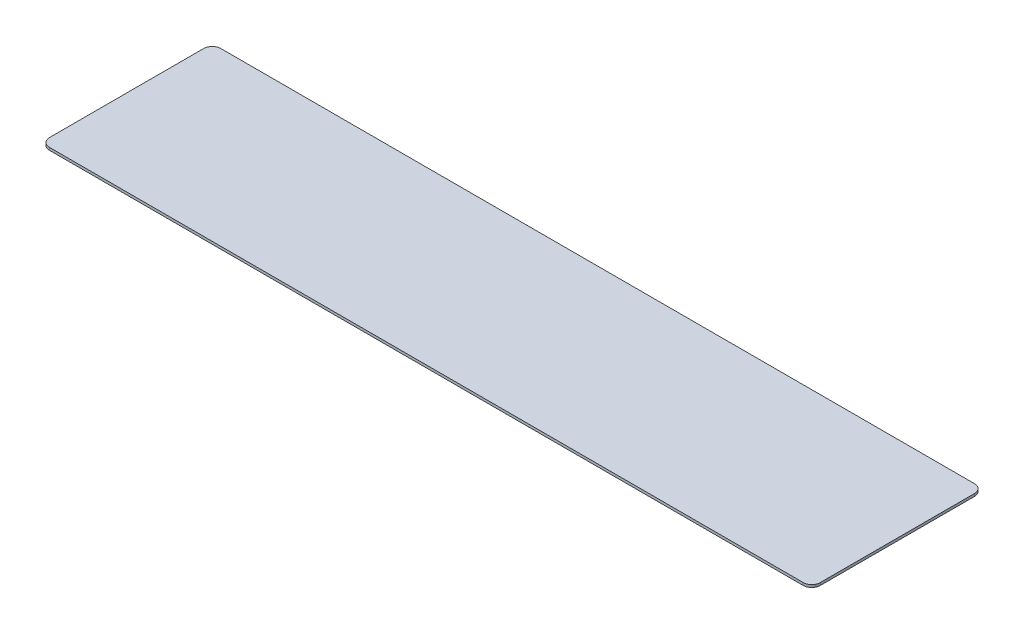
from build123d import *

# Parameters (mm, degrees)
SKETCH1_W           = 900
SKETCH1_H           = 200
BOSS_EXTRUDE1_DEPTH = 3
FILLET2_R           = 10


with BuildPart() as part:
    # Sketch1 → Boss-Extrude1 (new body)
    with BuildSketch(Plane(origin=(0, 0, 0), x_dir=(1, 0, 0), z_dir=(0, 1, 0))):
        with Locations((450, 100)):
            Rectangle(SKETCH1_W, SKETCH1_H)
    extrude(amount=BOSS_EXTRUDE1_DEPTH)

    # Fillet2
    fillet2_edges = [part.edges().sort_by_distance(p)[0] for p in [
        (0, 1.5, -200),
        (900, 1.5, -200),
        (900, 1.5, 0),
        (0, 1.5, 0),
    ]]
    fillet(fillet2_edges, radius=FILLET2_R)


solid = part.part
